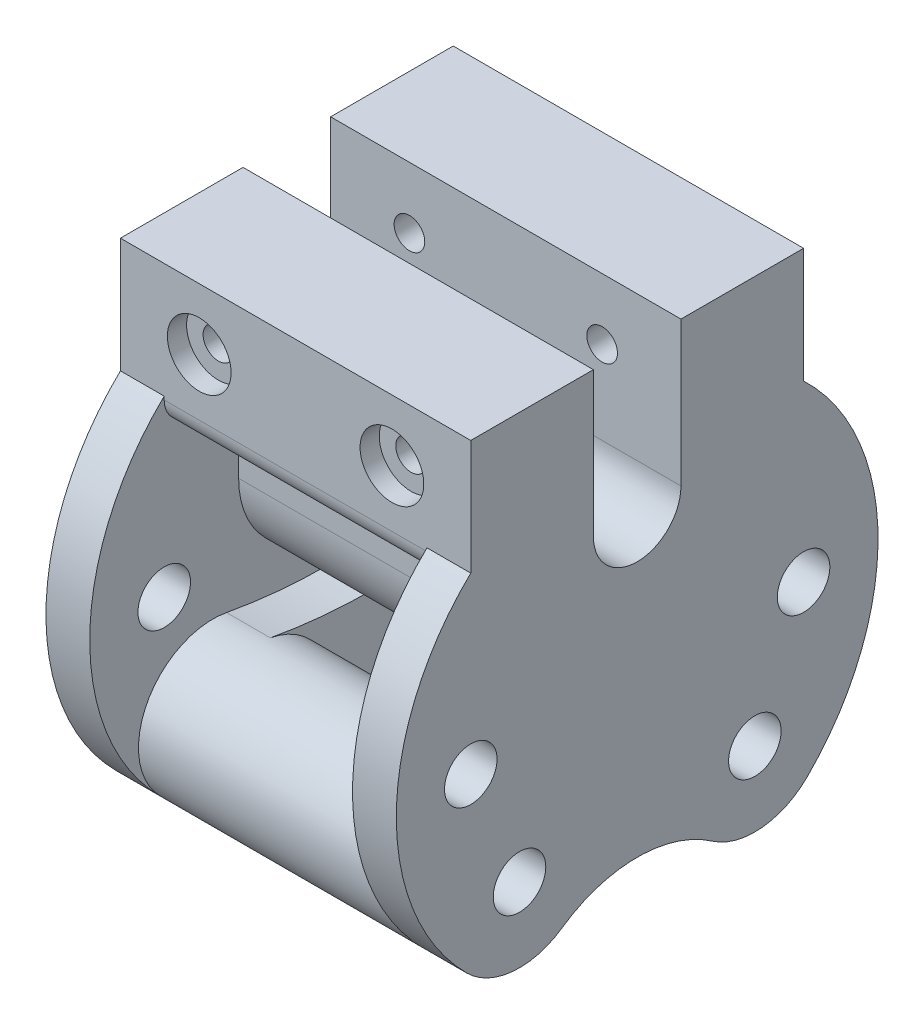
from build123d import *

# Parameters (mm, degrees)
SKETCH3_R               = 17
BOSS_EXTRUDE1_DEPTH     = 30
BOSS_EXTRUDE1_2_DEPTH   = 30
BOSS_EXTRUDE1_3_DEPTH   = 30
BOSS_EXTRUDE2_START     = 10
SKETCH4_R               = 6
BOSS_EXTRUDE2_DEPTH     = 10
CUT_EXTRUDE1_DEPTH      = 112.955374005
CUT_EXTRUDE1_DEPTH_BACK = 112.955374005
SKETCH4_4_R             = 6
SKETCH5_R               = 7.275
SKETCH5_R_2             = 3.5
CUT_EXTRUDE2_DEPTH      = 4.38
CUT_EXTRUDE3_DEPTH      = 128.114144644
CUT_EXTRUDE3_DEPTH_BACK = 128.114144644
SKETCH5_2_R             = 3.5
BOSS_EXTRUDE3_DEPTH     = 10


with BuildPart() as part:
    # Sketch3 → Boss-Extrude1 (new, symmetric)
    with BuildSketch(Plane(origin=(0, 0, 0), x_dir=(0, 0, -1), z_dir=(1, 0, 0))):
        with Locations((-26.870057685, -59.870057685)):
            Circle(SKETCH3_R)
    extrude(amount=BOSS_EXTRUDE1_DEPTH, both=True)



with BuildPart() as body_2:
    # Sketch3 → Boss-Extrude1 2 (new, symmetric)
    with BuildSketch(Plane(origin=(0, 0, 0), x_dir=(0, 0, -1), z_dir=(1, 0, 0))):
        with Locations((26.870057685, -59.870057685)):
            Circle(SKETCH3_R)
    extrude(amount=BOSS_EXTRUDE1_2_DEPTH, both=True)


with BuildPart() as body_3:
    # Sketch3 → Boss-Extrude1 3 (new, symmetric)
    with BuildSketch(Plane(origin=(0, 0, 0), x_dir=(0, 0, -1), z_dir=(1, 0, 0))):
        with BuildLine():
            Line((-38, 6), (-38, 33))
            Line((-38, 33), (-10, 33))
            Line((-10, 33), (-10, 0))
            ThreePointArc((-10, 0), (0, -10), (10, 0))
            Line((10, 0), (10, 33))
            Line((10, 33), (38, 33))
            Line((38, 33), (38, 6))
            ThreePointArc((38, 6), (36.242640687, 1.757359313), (32, 0))
            Line((32, 0), (27, 0))
            ThreePointArc((27, 0), (22.757359313, -1.757359313), (21, -6))
            Line((21, -6), (21, -18))
            ThreePointArc((21, -18), (0, -39), (-21, -18))
            Line((-21, -18), (-21, -6))
            ThreePointArc((-21, -6), (-22.757359313, -1.757359313), (-27, 0))
            Line((-27, 0), (-32, 0))
            ThreePointArc((-32, 0), (-36.242640687, 1.757359313), (-38, 6))
        make_face()
    extrude(amount=BOSS_EXTRUDE1_3_DEPTH, both=True)


with BuildPart() as part_1:
    add(part.part)

    add(body_2.part)  # Boss-Extrude2 merges body 2

    add(body_3.part)  # Boss-Extrude2 merges body 3
    # Sketch4 → Boss-Extrude2 (add)
    with BuildSketch(Plane(origin=(30, 0, 0), x_dir=(0, 0, -1), z_dir=(1, 0, 0)).offset(BOSS_EXTRUDE2_START)):
        with BuildLine():
            ThreePointArc((-17.15110065, -73.817884546), (0, -68.431696654), (17.15110065, -73.817884546))
            ThreePointArc((17.15110065, -73.817884546), (28.371051107, -76.803663879), (38.890872965, -71.890872965))
            ThreePointArc((38.890872965, -71.890872965), (54.996472268, -32.377072968), (38, 6.761790704))
            Line((38, 6.761790704), (38, 33))
            Line((38, 33), (10, 33))
            Line((10, 33), (10, 0))
            ThreePointArc((10, 0), (0, -10), (-10, 0))
            Line((-10, 0), (-10, 33))
            Line((-10, 33), (-38, 33))
            Line((-38, 33), (-38, 6.761790704))
            ThreePointArc((-38, 6.761790704), (-54.996472268, -32.377072968), (-38.890872965, -71.890872965))
            ThreePointArc((-38.890872965, -71.890872965), (-28.371051107, -76.803663879), (-17.15110065, -73.817884546))
        make_face()
        with Locations((-26.870057685, -59.870057685)):
            Circle(SKETCH4_R, mode=Mode.SUBTRACT)
        with Locations((-38, -33)):
            Circle(SKETCH4_R, mode=Mode.SUBTRACT)
        with Locations((38, -33)):
            Circle(SKETCH4_R, mode=Mode.SUBTRACT)
        with Locations((26.870057685, -59.870057685)):
            Circle(SKETCH4_R, mode=Mode.SUBTRACT)
    boss_extrude2 = extrude(amount=-BOSS_EXTRUDE2_DEPTH)

    # Sketch4<4> → Cut-Extrude1 (cut, two sides: drawn at the far end of the back side and taken through both)
    with BuildSketch(Plane(origin=(30, 0, 0), x_dir=(0, 0, -1), z_dir=(1, 0, 0)).offset(-CUT_EXTRUDE1_DEPTH_BACK)):
        with Locations((-26.870057685, -59.870057685)):
            Circle(SKETCH4_4_R)
        with Locations((26.870057685, -59.870057685)):
            Circle(SKETCH4_4_R)
    extrude(amount=CUT_EXTRUDE1_DEPTH + CUT_EXTRUDE1_DEPTH_BACK, mode=Mode.SUBTRACT)

    # Mirror1: Boss-Extrude2 across plane
    add(boss_extrude2.mirror(Plane(origin=(0, 0, 0), x_dir=(0, 0, 1), z_dir=(1, 0, 0))))

    # Sketch5 → Cut-Extrude2 (cut)
    # profile 1 of 2: a face of its own
    with BuildSketch(Plane(origin=(0, 0, 38), x_dir=(-1, 0, 0), z_dir=(0, 0, -1))):
        with Locations((22, 19)):
            Circle(SKETCH5_R)
        with Locations((22, 19)):
            Circle(SKETCH5_R_2, mode=Mode.SUBTRACT)
    # profile 2 of 2: a face of its own
    with BuildSketch(Plane(origin=(0, 0, 38), x_dir=(-1, 0, 0), z_dir=(0, 0, -1))):
        with Locations((-22, 19)):
            Circle(SKETCH5_R)
        with Locations((-22, 19)):
            Circle(SKETCH5_R_2, mode=Mode.SUBTRACT)
    extrude(amount=CUT_EXTRUDE2_DEPTH, mode=Mode.SUBTRACT)

    # Sketch5<2> → Cut-Extrude3 (cut, two sides: drawn at the far end of the back side and taken through both)
    with BuildSketch(Plane(origin=(0, 0, 38), x_dir=(-1, 0, 0), z_dir=(0, 0, -1)).offset(-CUT_EXTRUDE3_DEPTH_BACK)):
        with Locations((22, 19)):
            Circle(SKETCH5_2_R)
        with Locations((-22, 19)):
            Circle(SKETCH5_2_R)
    extrude(amount=CUT_EXTRUDE3_DEPTH + CUT_EXTRUDE3_DEPTH_BACK, mode=Mode.SUBTRACT)

    # Sketch4<5> → Boss-Extrude3 (add)
    with BuildSketch(Plane(origin=(30, 0, 0), x_dir=(0, 0, -1), z_dir=(1, 0, 0))):
        with BuildLine():
            ThreePointArc((23.762636048, -43.156472469), (0, -45.346703171), (-23.762636048, -43.156472469))
            ThreePointArc((-23.762636048, -43.156472469), (-13.796684596, -49.003277293), (-9.870057685, -59.870057685))
            ThreePointArc((-9.870057685, -59.870057685), (-11.799850825, -67.737005327), (-17.15110065, -73.817884546))
            ThreePointArc((-17.15110065, -73.817884546), (0, -68.431696654), (17.15110065, -73.817884546))
            ThreePointArc((17.15110065, -73.817884546), (10.25200891, -56.286699637), (23.762636048, -43.156472469))
        make_face()
    boss_extrude3 = extrude(amount=-BOSS_EXTRUDE3_DEPTH)

    # Mirror2: Boss-Extrude3 across plane
    add(boss_extrude3.mirror(Plane(origin=(0, 0, 0), x_dir=(0, 0, 1), z_dir=(1, 0, 0))))


solid = part_1.part
